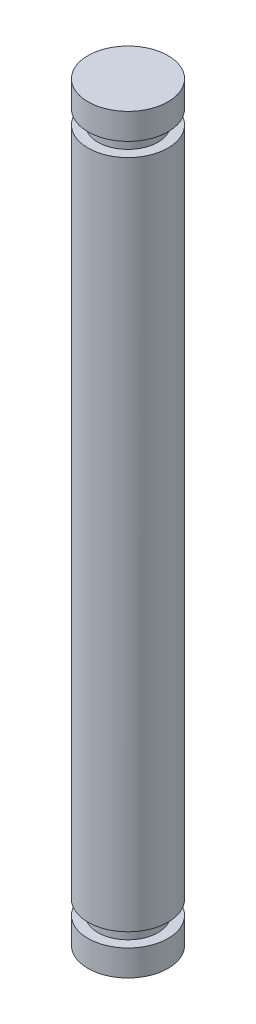
from build123d import *

# Parameters (mm, degrees)
SKETCH_1_R          = 2
EXTRUDE_1_DEPTH     = 37.5
CUT_EXTRUDE_START   = -2
SKETCH_2_R          = 2
SKETCH_2_R_2        = 1.5
CUT_EXTRUDE_1_DEPTH = 0.7
CUT_EXTRUDE_START_2 = -1.3
SKETCH_3_R          = 2
SKETCH_3_R_2        = 1.5
CUT_EXTRUDE_2_DEPTH = 0.7


with BuildPart() as part:
    # 스케치1 → 보스-돌출1 (new body)
    with BuildSketch(Plane(origin=(0, 0, 0), x_dir=(1, 0, 0), z_dir=(0, 1, 0))):
        with Locations(Location((0, 0, 0), (0, 0, 270))):
            Circle(SKETCH_1_R)
    extrude(amount=EXTRUDE_1_DEPTH)

    # 스케치2 → 컷-돌출1 (cut)
    with BuildSketch(Plane(origin=(0, 37.5, 0), x_dir=(1, 0, 0), z_dir=(0, 1, 0)).offset(CUT_EXTRUDE_START)):
        with Locations(Location((0, 0, 0), (0, 0, 270))):
            Circle(SKETCH_2_R)
        with Locations(Location((0, 0, 0), (0, 0, 270))):
            Circle(SKETCH_2_R_2, mode=Mode.SUBTRACT)
    extrude(amount=CUT_EXTRUDE_1_DEPTH, mode=Mode.SUBTRACT)

    # 스케치3 → 컷-돌출2 (cut)
    with BuildSketch(Plane.XZ.offset(CUT_EXTRUDE_START_2)):
        with Locations(Location((0, 0, 0), (0, 0, 270))):
            Circle(SKETCH_3_R)
        with Locations(Location((0, 0, 0), (0, 0, 90))):
            Circle(SKETCH_3_R_2, mode=Mode.SUBTRACT)
    extrude(amount=-CUT_EXTRUDE_2_DEPTH, mode=Mode.SUBTRACT)


solid = part.part
